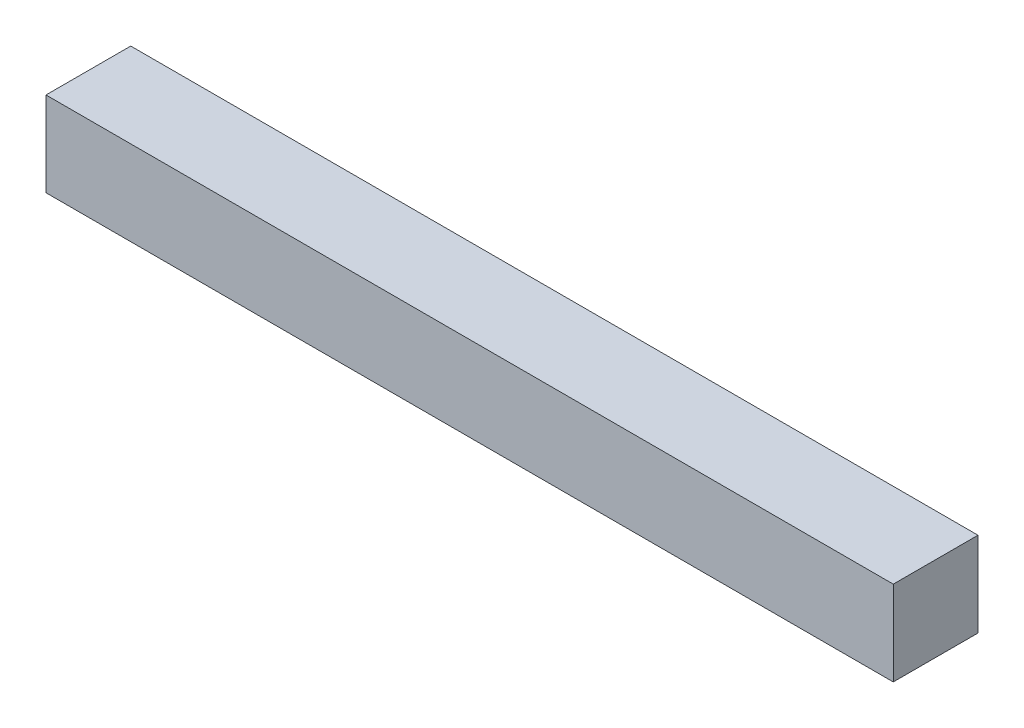
from build123d import *

# Parameters (mm, degrees)
SKETCH1_W           = 100
SKETCH1_H           = 10
BOSS_EXTRUDE1_DEPTH = 10


with BuildPart() as part:
    # Sketch1 → Boss-Extrude1 (new body)
    with BuildSketch(Plane.XY):
        with Locations((50, 5)):
            Rectangle(SKETCH1_W, SKETCH1_H)
    extrude(amount=BOSS_EXTRUDE1_DEPTH)


solid = part.part
